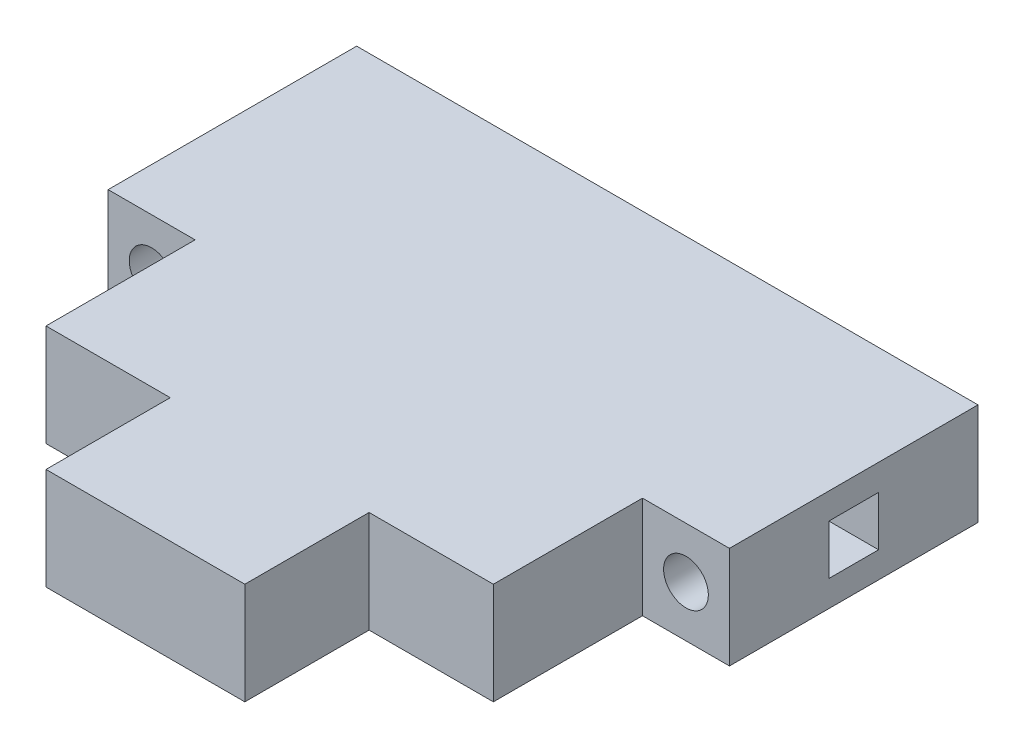
from build123d import *

# Parameters (mm, degrees)
BODY_DEPTH   = 8.2
SKETCH2_R    = 1.8
SCREWS_DEPTH = 6
SKETCH3_W    = 4
SKETCH3_H    = 4
WIRE_R_DEPTH = 8
SKETCH4_W    = 4
SKETCH4_H    = 4
WIRE_L_DEPTH = 8


with BuildPart() as part:
    # Sketch1 → Body (new body)
    with BuildSketch(Plane(origin=(0, 0, 0), x_dir=(1, 0, 0), z_dir=(0, 1, 0))):
        Polygon((-25, 0), (25, 0), (25, -20), (18, -20), (18, -32), (8, -32), (8, -42), (-8, -42), (-8, -32), (-18, -32), (-18, -20), (-25, -20), align=None)
    extrude(amount=BODY_DEPTH)

    # Sketch2 → Screws (cut)
    with BuildSketch(Plane.XY.offset(20)):
        with Locations((-21.5, 4.1)):
            Circle(SKETCH2_R)
        with Locations((21.5, 4.1)):
            Circle(SKETCH2_R)
    extrude(amount=-SCREWS_DEPTH, mode=Mode.SUBTRACT)

    # Sketch3 → Wire_R (cut)
    with BuildSketch(Plane(origin=(25, 0, 0), x_dir=(0, 0, -1), z_dir=(1, 0, 0))):
        with Locations((-10, 4.1)):
            Rectangle(SKETCH3_W, SKETCH3_H)
    extrude(amount=-WIRE_R_DEPTH, mode=Mode.SUBTRACT)

    # Sketch4 → Wire_L (cut)
    with BuildSketch(Plane(origin=(-25, 0, 0), x_dir=(0, 0, -1), z_dir=(1, 0, 0))):
        with Locations((-10, 4.1)):
            Rectangle(SKETCH4_W, SKETCH4_H)
    extrude(amount=WIRE_L_DEPTH, mode=Mode.SUBTRACT)


solid = part.part
